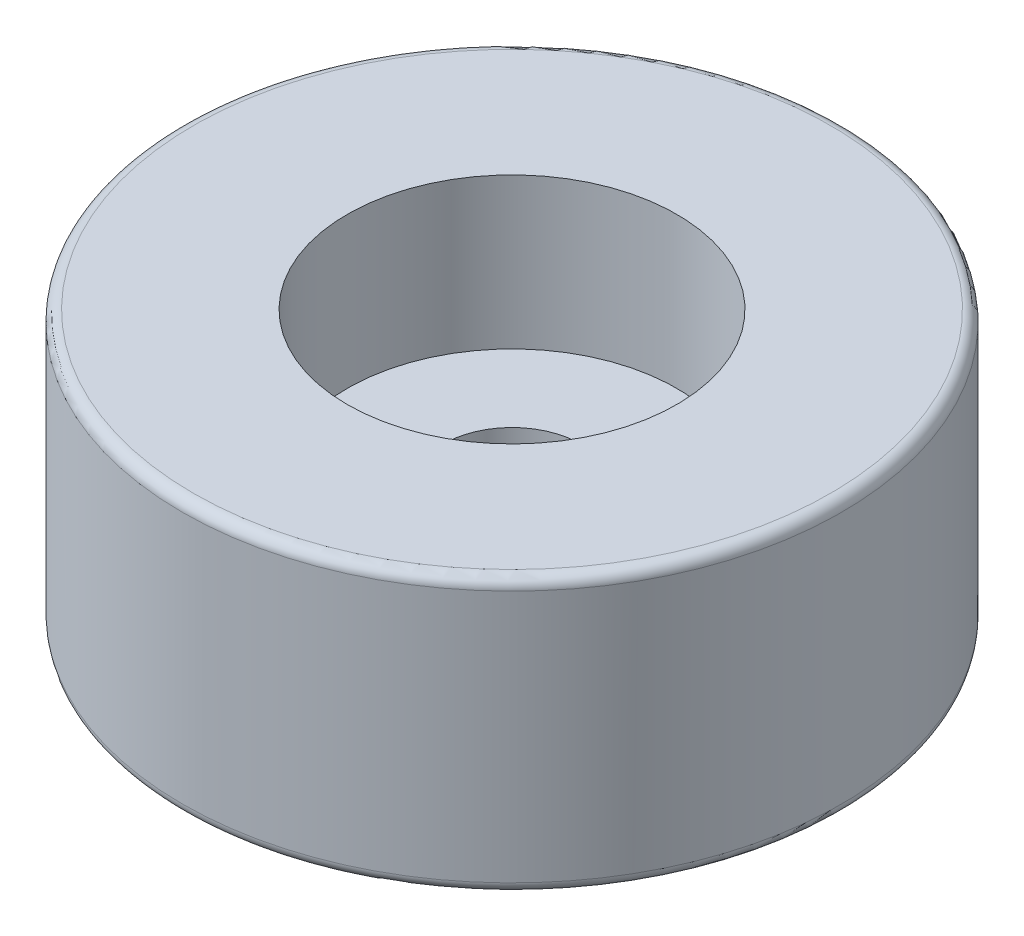
from build123d import *

# Parameters (mm, degrees)
FILLET1_R = 0.635


with BuildPart() as part:
    # Sketch1 → Revolve1 (revolve)
    with BuildSketch(Plane.XY, mode=Mode.PRIVATE) as revolve1_sk:
        Polygon((-19.05, 5.016926272), (-19.05, -10.858073728), (-3.9624, -10.858073728), (-3.9624, -3.695273728), (-9.525, -3.695273728), (-9.525, 5.016926272), align=None)
    revolve(revolve1_sk.sketch.rotate(Axis((0, 5.016926272, 0), (0, -1, 0)), 270), axis=Axis((0, 5.016926272, 0), (0, -1, 0)))

    # Fillet1
    fillet1_edges = [part.edges().sort_by_distance(p)[0] for p in [
        (0, 5.016926272, -19.05),
        (0, -10.858073728, -19.05),
    ]]
    fillet(fillet1_edges, radius=FILLET1_R)


solid = part.part
